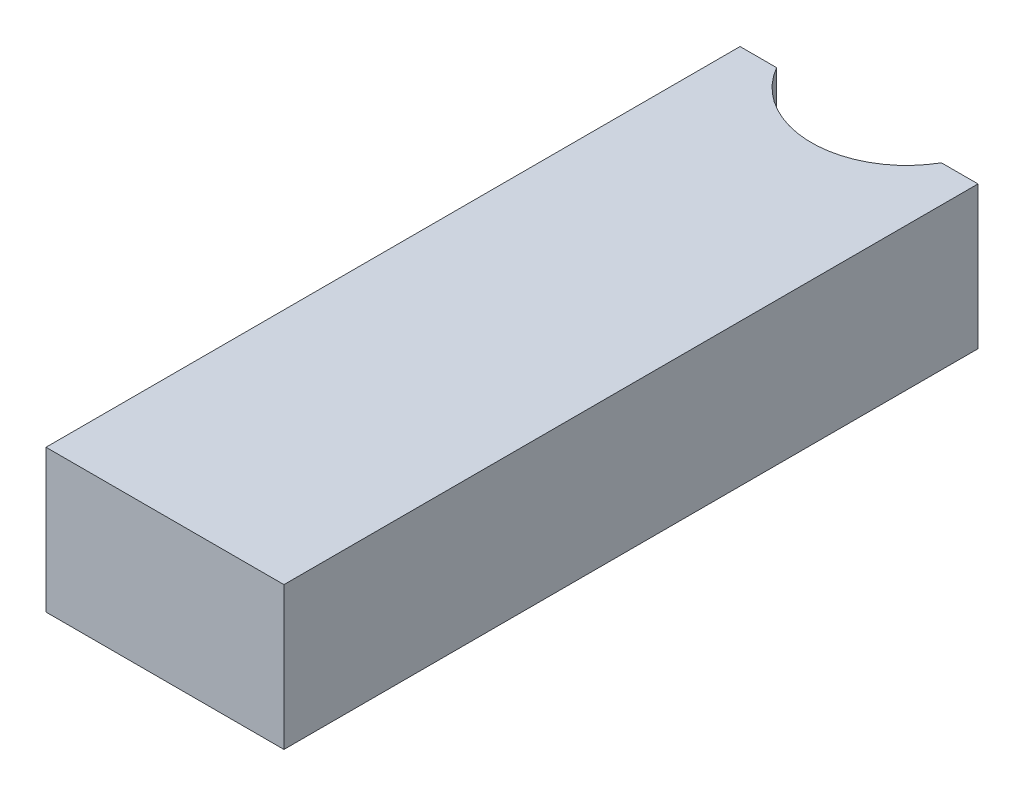
from build123d import *

# Parameters (mm, degrees)
SKETCH1_W           = 31.75
SKETCH1_H           = 19.05
BOSS_EXTRUDE1_DEPTH = 92.6084
SKETCH2_R           = 12.7
CUT_EXTRUDE1_DEPTH  = 96.870922993


with BuildPart() as part:
    # Sketch1 → Boss-Extrude1 (new body)
    with BuildSketch(Plane.XY):
        Rectangle(SKETCH1_W, SKETCH1_H)
    extrude(amount=BOSS_EXTRUDE1_DEPTH)

    # Sketch2 → Cut-Extrude1 (cut, through all)
    with BuildSketch(Plane(origin=(0, 9.525, 0), x_dir=(1, 0, 0), z_dir=(0, 1, 0))):
        with Locations((0, 6.35)):
            Circle(SKETCH2_R)
    extrude(amount=-CUT_EXTRUDE1_DEPTH, mode=Mode.SUBTRACT)


solid = part.part
